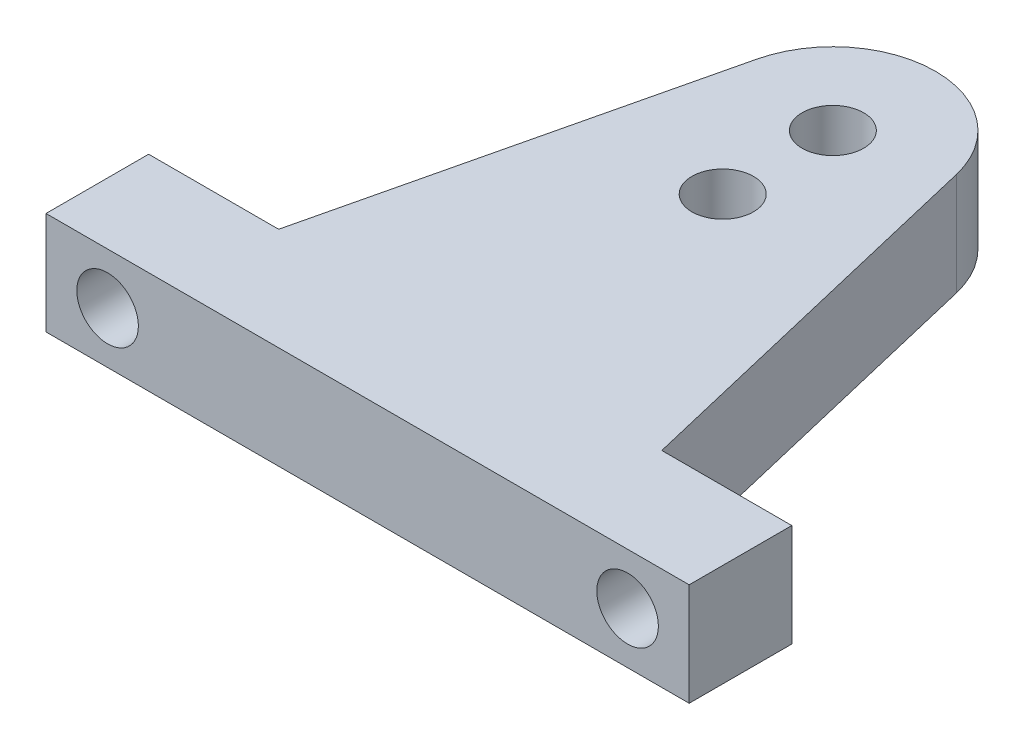
from build123d import *

# Parameters (mm, degrees)
SALIENTE_EXTRUIR1_DEPTH = 15
CORTAR_EXTRUIR1_REACH   = 98.556
CROQUIS2_R              = 4.5
CORTAR_EXTRUIR2_REACH   = 98.556
CROQUIS3_R              = 4.5


with BuildPart() as part:
    # Croquis1 → Saliente-Extruir1 (new body)
    with BuildSketch(Plane(origin=(0, 0, 0), x_dir=(1, 0, 0), z_dir=(0, 1, 0))):
        with BuildLine():
            Line((47, 0), (-47, 0))
            Line((-47, 0), (-47, 15))
            Line((-47, 15), (-28, 15))
            Line((-28, 15), (-14.594323866, 71.464925816))
            ThreePointArc((-14.594323866, 71.464925816), (0, 83), (14.594323866, 71.464925816))
            Line((14.594323866, 71.464925816), (28, 15))
            Line((28, 15), (47, 15))
            Line((47, 15), (47, 0))
        make_face()
    extrude(amount=SALIENTE_EXTRUIR1_DEPTH)

    # Croquis2 → Cortar-Extruir1 (cut, up to next)
    with BuildSketch(Plane.XY, mode=Mode.PRIVATE) as cortar_extruir1_sk1:
        with Locations((-38, 7.5)):
            Circle(CROQUIS2_R)
    cortar_extruir1_tool1 = extrude(cortar_extruir1_sk1.sketch, amount=-CORTAR_EXTRUIR1_REACH, mode=Mode.PRIVATE) & part.part
    # Croquis2 → Cortar-Extruir1 (cut, up to next)
    with BuildSketch(Plane.XY, mode=Mode.PRIVATE) as cortar_extruir1_sk2:
        with Locations((38, 7.5)):
            Circle(CROQUIS2_R)
    cortar_extruir1_tool2 = extrude(cortar_extruir1_sk2.sketch, amount=-CORTAR_EXTRUIR1_REACH, mode=Mode.PRIVATE) & part.part
    add(cortar_extruir1_tool1.solids().sort_by_distance((-38, 7.5, 0))[0], mode=Mode.SUBTRACT)
    add(cortar_extruir1_tool2.solids().sort_by_distance((38, 7.5, 0))[0], mode=Mode.SUBTRACT)

    # Croquis3 → Cortar-Extruir2 (cut, up to next)
    with BuildSketch(Plane(origin=(0, 15, 0), x_dir=(1, 0, 0), z_dir=(0, 1, 0)), mode=Mode.PRIVATE) as cortar_extruir2_sk1:
        with Locations(Location((0, 68, 0), (0, 0, 270))):
            Circle(CROQUIS3_R)
    cortar_extruir2_tool1 = extrude(cortar_extruir2_sk1.sketch, amount=-CORTAR_EXTRUIR2_REACH, mode=Mode.PRIVATE) & part.part
    # Croquis3 → Cortar-Extruir2 (cut, up to next)
    with BuildSketch(Plane(origin=(0, 15, 0), x_dir=(1, 0, 0), z_dir=(0, 1, 0)), mode=Mode.PRIVATE) as cortar_extruir2_sk2:
        with Locations(Location((0, 51.9, 0), (0, 0, 270))):
            Circle(CROQUIS3_R)
    cortar_extruir2_tool2 = extrude(cortar_extruir2_sk2.sketch, amount=-CORTAR_EXTRUIR2_REACH, mode=Mode.PRIVATE) & part.part
    add(cortar_extruir2_tool1.solids().sort_by_distance((0, 15, -68))[0], mode=Mode.SUBTRACT)
    add(cortar_extruir2_tool2.solids().sort_by_distance((0, 15, -51.9))[0], mode=Mode.SUBTRACT)


solid = part.part
